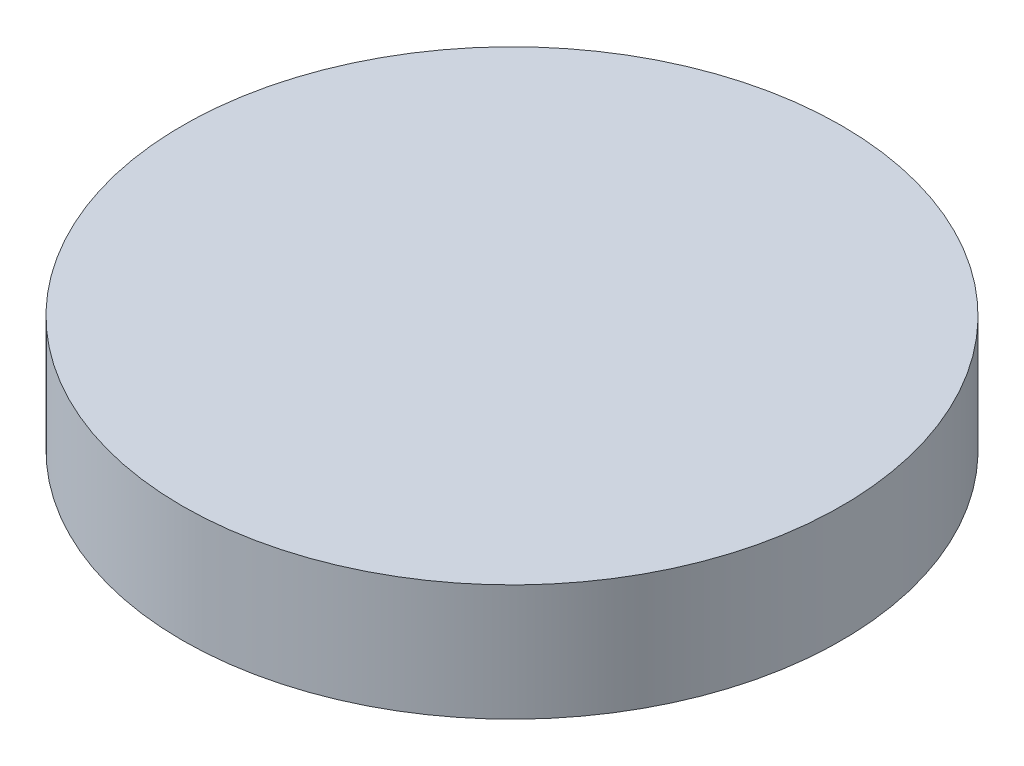
from build123d import *

# Parameters (mm, degrees)
SKETCH1_R           = 53.975
BOSS_EXTRUDE1_DEPTH = 19.05


with BuildPart() as part:
    # Sketch1 → Boss-Extrude1 (new body)
    with BuildSketch(Plane(origin=(0, 0, 0), x_dir=(1, 0, 0), z_dir=(0, 1, 0))):
        with Locations(Location((0, 0, 0), (0, 0, 90))):
            Circle(SKETCH1_R)
    extrude(amount=BOSS_EXTRUDE1_DEPTH)


solid = part.part
